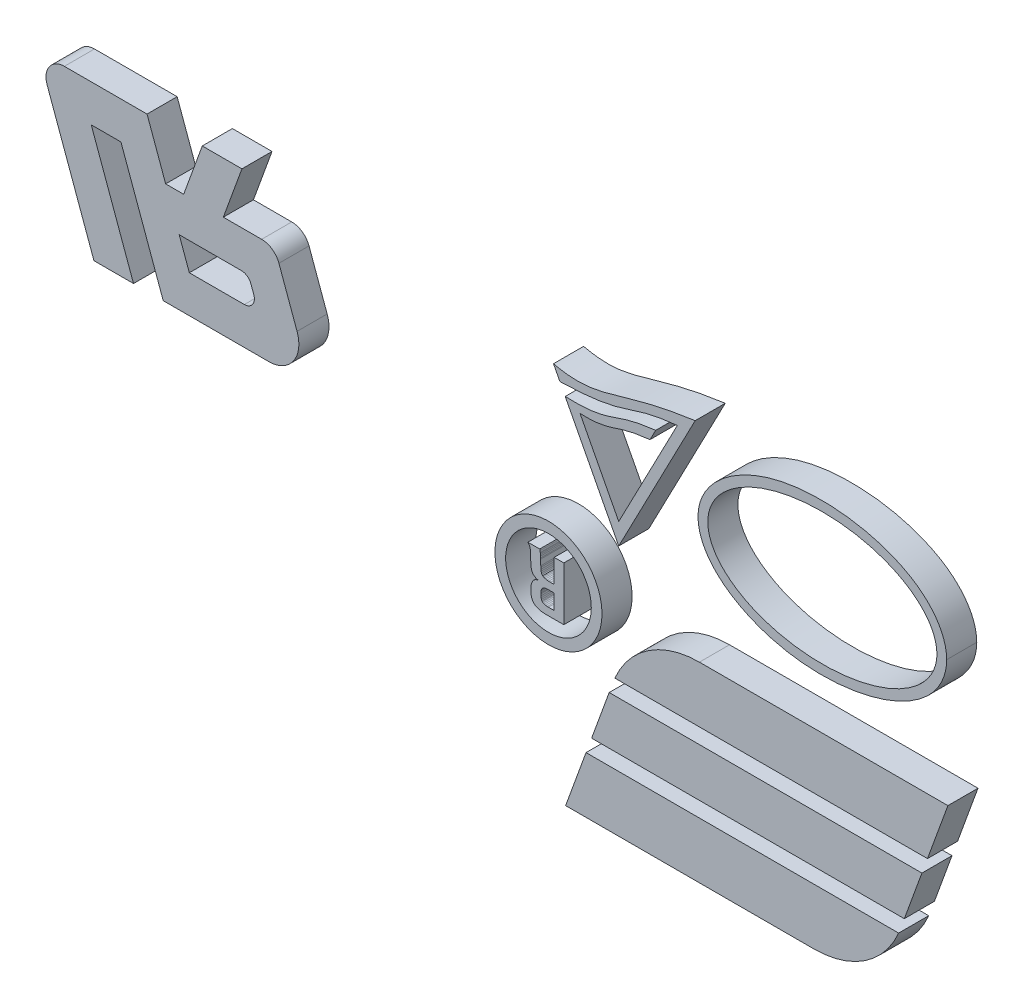
from build123d import *

# Parameters (mm, degrees)
SKETCH_1_R        = 0.889
SKETCH_1_R_2      = 0.7112
EXTRUDE_1_DEPTH   = 0.5
EXTRUDE_1_2_DEPTH = 0.5
EXTRUDE_1_3_DEPTH = 0.5
EXTRUDE_1_4_DEPTH = 0.5
EXTRUDE_1_5_DEPTH = 0.5
EXTRUDE_1_6_DEPTH = 0.5
EXTRUDE_1_7_DEPTH = 0.5
SKETCH_1_RX       = 1.902570153
SKETCH_1_RY       = 1.096871421
EXTRUDE_1_8_DEPTH = 0.5


with BuildPart() as part:
    # 草圖1 → 填料-伸長1 (new body)
    with BuildSketch(Plane.XY):
        with Locations((7.824620046, 6.186033695)):
            Circle(SKETCH_1_R)
        with Locations((7.824620046, 6.186033695)):
            Circle(SKETCH_1_R_2, mode=Mode.SUBTRACT)
    extrude(amount=EXTRUDE_1_DEPTH)


with BuildPart() as body_2:
    # 草圖1 → Extrude 1 2 (new body)
    with BuildSketch(Plane.XY):
        with BuildLine():
            Line((8.448576012, 4.057698906), (13.640963376, 4.057698906))
            ThreePointArc((13.640963376, 4.057698906), (13.079373986, 3.379772931), (12.236568457, 3.125518906))
            Line((12.236568457, 3.125518906), (8.109290239, 3.125518906))
            Line((8.109290239, 3.125518906), (8.448576012, 4.057698906))
        make_face()
    extrude(amount=EXTRUDE_1_2_DEPTH)


with BuildPart() as body_3:
    # 草圖1 → Extrude 1 3 (new body)
    with BuildSketch(Plane.XY):
        with BuildLine():
            Line((8.927617103, 5.368338906), (14.120004466, 5.368338906))
            Line((14.120004466, 5.368338906), (14.459290239, 6.300518906))
            Line((14.459290239, 6.300518906), (10.332012021, 6.300518906))
            ThreePointArc((10.332012021, 6.300518906), (9.489206492, 6.04626488), (8.927617103, 5.368338906))
        make_face()
    extrude(amount=EXTRUDE_1_3_DEPTH)


with BuildPart() as body_4:
    # 草圖1 → Extrude 1 4 (new body)
    with BuildSketch(Plane.XY):
        Polygon((14.027556027, 5.114338906), (13.735418958, 4.311698906), (8.541024452, 4.311698906), (8.833161521, 5.114338906), align=None)
    extrude(amount=EXTRUDE_1_4_DEPTH)


with BuildPart() as body_5:
    # 草圖1 → Extrude 1 5 (new body)
    with BuildSketch(Plane.XY):
        Polygon((7.919538281, 6.601565182), (7.919538281, 6.211288228), (7.8631351, 6.211288228), (7.858176578, 6.211288228), (7.82718582, 6.212321253), (7.799913952, 6.214800514), (7.776360975, 6.218932615), (7.75652689, 6.224510951), (7.740411695, 6.231535523), (7.728015392, 6.240212936), (7.716652114, 6.254055475), (7.707768096, 6.2714103), (7.701363339, 6.29269062), (7.697644448, 6.317689832), (7.696404818, 6.346407936), (7.696404818, 6.369960912), (7.694132162, 6.462933188), (7.693718952, 6.480081408), (7.692685927, 6.50590704), (7.691239692, 6.528220386), (7.689380246, 6.546608237), (7.688140616, 6.556731884), (7.68421512, 6.580284861), (7.679049993, 6.601565182), (7.482981793, 6.601565182), (7.494551677, 6.588342458), (7.506741375, 6.568921583), (7.515831998, 6.547228052), (7.518517863, 6.539170455), (7.52326978, 6.518509949), (7.526575461, 6.494956972), (7.528021696, 6.46871813), (7.530294352, 6.350333432), (7.530914167, 6.328020085), (7.532773612, 6.299301982), (7.535872688, 6.273682955), (7.540004789, 6.250956399), (7.545169916, 6.230915708), (7.551574673, 6.213974093), (7.55921906, 6.199718344), (7.560252085, 6.198065504), (7.572854993, 6.182570125), (7.588556978, 6.168934191), (7.607564643, 6.157364308), (7.629877989, 6.147860475), (7.655497017, 6.140422693), (7.63194404, 6.135257566), (7.611283534, 6.126993364), (7.592895684, 6.115423481), (7.576573885, 6.100341312), (7.562524741, 6.081953461), (7.560665295, 6.078854386), (7.551368067, 6.061292956), (7.54372368, 6.04187208), (7.537938739, 6.020591759), (7.533600032, 5.997451993), (7.531120772, 5.972246176), (7.530294352, 5.945180913), (7.530500957, 5.930511954), (7.532153797, 5.903446691), (7.535459478, 5.878240874), (7.540417999, 5.854894503), (7.546822756, 5.833614182), (7.554880353, 5.813986701), (7.564797396, 5.796425272), (7.576160674, 5.780723287), (7.589176793, 5.766880748), (7.603639147, 5.755310865), (7.619547737, 5.745187217), (7.637315772, 5.736509805), (7.656943252, 5.729278628), (7.678430178, 5.723287081), (7.70177655, 5.718535165), (7.726982367, 5.715229484), (7.754047629, 5.713163433), (7.782972337, 5.712543618), (8.07924399, 5.712543618), (8.07924399, 6.601565182), align=None)
        Polygon((7.919538281, 5.836713258), (7.824499954, 5.836713258), (7.805079079, 5.837333073), (7.779046841, 5.840225544), (7.7569401, 5.84580388), (7.738758855, 5.853861478), (7.724709711, 5.864398336), (7.717065324, 5.873488958), (7.707974701, 5.890223968), (7.701569945, 5.910884474), (7.697644448, 5.935677081), (7.696404818, 5.964188578), (7.696818028, 5.979477353), (7.699710499, 6.00550959), (7.705288836, 6.027616331), (7.713966248, 6.045797576), (7.725329526, 6.060053325), (7.734006939, 6.067284502), (7.750741948, 6.07658173), (7.771609059, 6.083193092), (7.795988456, 6.087118588), (7.824499954, 6.088358218), (7.919538281, 6.088358218), align=None, mode=Mode.SUBTRACT)
    extrude(amount=EXTRUDE_1_5_DEPTH)


with BuildPart() as body_6:
    # 草圖1 → Extrude 1 6 (new body)
    with BuildSketch(Plane.XY):
        with BuildLine():
            Line((7.907906052, 9.381456034), (8.013954697, 9.177842636))
            add(Edge.make_bspline(
                [(8.013954697, 9.177842636), (9.202583564, 9.208703992), (9.06746162, 9.436235238), (9.965079322, 9.52187855)],
                knots=[0, 0, 0, 0, 1, 1, 1, 1], degree=3))
            Line((9.965079322, 9.52187855), (8.991567924, 7.652736666))
            Line((8.991567924, 7.652736666), (8.349150686, 8.886177764))
            add(Edge.make_bspline(
                [(9.511635217, 9.091155152), (8.872328744, 9.024542452), (8.924079312, 8.871067484), (8.349150686, 8.886177764)],
                knots=[0, 0, 0, 0, 1, 1, 1, 1], degree=3))
            Line((9.511635217, 9.091155152), (9.606301905, 9.272915193))
            add(Edge.make_bspline(
                [(9.606301905, 9.272915193), (8.840115122, 9.188083566), (8.900448019, 8.977404436), (8.102538787, 9.007761183)],
                knots=[0, 0, 0, 0, 1, 1, 1, 1], degree=3))
            Line((8.102538787, 9.007761183), (8.991567924, 7.300825241))
            Line((8.991567924, 7.300825241), (10.261567924, 9.739225241))
            add(Edge.make_bspline(
                [(10.261567924, 9.739225241), (8.921312557, 9.55739804), (8.689689544, 9.200472508), (7.907906052, 9.381456034)],
                knots=[0, 0, 0, 0, 1, 1, 1, 1], degree=3))
        make_face()
    extrude(amount=EXTRUDE_1_6_DEPTH)


with BuildPart() as body_7:
    # 草圖1 → Extrude 1 7 (new body)
    with BuildSketch(Plane.XY):
        with BuildLine():
            Line((3.648400437, 7.717338976), (3.347189613, 8.546157624))
            ThreePointArc((3.347189613, 8.546157624), (3.235404155, 8.691948886), (3.060199048, 8.747214167))
            Line((3.060199048, 8.747214167), (2.423711702, 8.747214167))
            Line((2.423711702, 8.747214167), (2.732637212, 9.597260723))
            Line((2.732637212, 9.597260723), (2.074075306, 9.597260723))
            Line((2.074075306, 9.597260723), (1.765149796, 8.747214167))
            Line((1.765149796, 8.747214167), (1.465653194, 8.747214167))
            Line((1.465653194, 8.747214167), (1.156727684, 9.597260723))
            Line((1.156727684, 9.597260723), (-0.216419324, 9.597260723))
            ThreePointArc((-0.216419324, 9.597260723), (-0.466509234, 9.467110639), (-0.503409889, 9.187606883))
            Line((-0.503409889, 9.187606883), (0.274692026, 7.046563713))
            Line((0.274692026, 7.046563713), (0.931865953, 7.046563713))
            Line((0.931865953, 7.046563713), (0.229634017, 8.978841301))
            Line((0.229634017, 8.978841301), (0.722894497, 8.979273917))
            Line((0.722894497, 8.979273917), (1.425126434, 7.046996329))
            Line((1.425126434, 7.046996329), (3.178779512, 7.046996329))
            ThreePointArc((3.178779512, 7.046996329), (3.588017547, 7.259969194), (3.648400437, 7.717338976))
        make_face()
        with BuildLine():
            Line((2.92897741, 7.888625033), (2.881561778, 8.019094979))
            ThreePointArc((2.881561778, 8.019094979), (2.820587892, 8.098617485), (2.72502147, 8.128762184))
            Line((2.72502147, 8.128762184), (1.690412171, 8.128762184))
            Line((1.690412171, 8.128762184), (1.85888899, 7.665177484))
            Line((1.85888899, 7.665177484), (2.772437101, 7.665177484))
            ThreePointArc((2.772437101, 7.665177484), (2.90884978, 7.736168439), (2.92897741, 7.888625033))
        make_face(mode=Mode.SUBTRACT)
    extrude(amount=EXTRUDE_1_7_DEPTH)


with BuildPart() as body_8:
    # 草圖1 → Extrude 1 8 (new body)
    with BuildSketch(Plane.XY):
        with BuildLine():
            add(Edge.make_bspline(
                [(10.316882212, 8.274782131), (10.402257091, 7.684151743), (11.143946605, 7.246347921), (12.838410216, 7.055705795), (13.765534918, 7.299190986), (14.348230312, 7.962823838), (14.438898128, 8.173755435), (14.438898128, 8.389130691)],
                knots=[3.224735905, 3.224735905, 3.224735905, 3.224735905, 4.519659891, 4.519659891, 5.814583877, 5.814583877, 6.283185307, 6.283185307, 6.283185307, 6.283185307], degree=3))
            add(Edge.make_bspline(
                [(14.438898128, 8.389130691), (14.438898128, 8.680933367), (14.272126572, 8.959237611), (13.462567368, 9.592838027), (12.482877783, 9.750625339), (10.858960547, 9.399280444), (10.231507333, 8.865412519), (10.316882212, 8.274782131)],
                knots=[0, 0, 0, 0, 0.634887934, 0.634887934, 1.92981192, 1.92981192, 3.224735905, 3.224735905, 3.224735905, 3.224735905], degree=3))
        make_face()
        with Locations(Location((12.373767975, 8.389130691), (0, 0, 0))):
            Ellipse(SKETCH_1_RX, SKETCH_1_RY, mode=Mode.SUBTRACT)
    extrude(amount=EXTRUDE_1_8_DEPTH)


solid = Compound([part.part, body_2.part, body_3.part, body_4.part, body_5.part, body_6.part, body_7.part, body_8.part])
